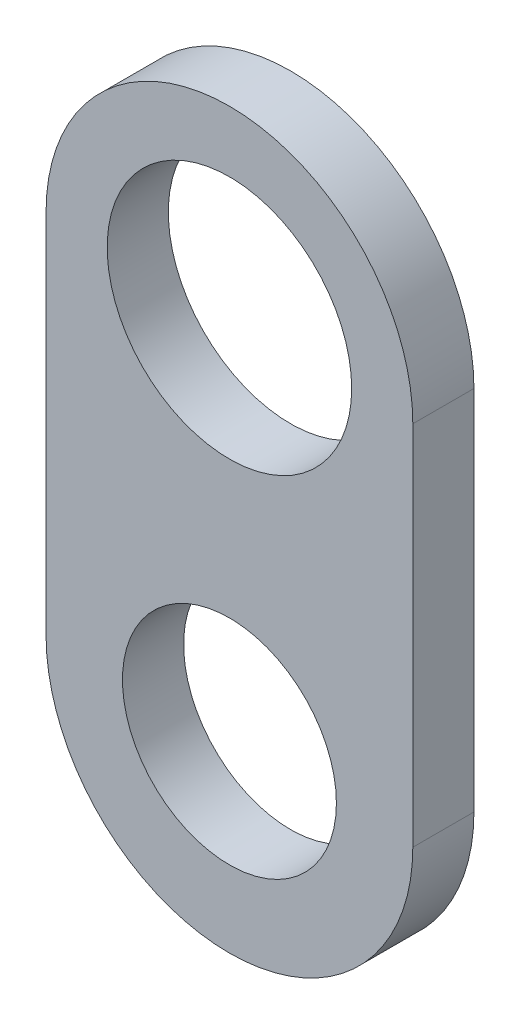
from build123d import *

# Parameters (mm, degrees)
BOSS_EXTRUDE1_DEPTH = 250
SKETCH2_R           = 500
SKETCH2_R_2         = 437.5
CUT_EXTRUDE1_DEPTH  = 250


with BuildPart() as part:
    # Sketch1 → Boss-Extrude1 (new body)
    with BuildSketch(Plane.XY):
        with BuildLine():
            Line((-750, 0), (-750, -1500))
            ThreePointArc((-750, -1500), (0, -2250), (750, -1500))
            Line((750, -1500), (750, 0))
            ThreePointArc((750, 0), (0, 750), (-750, 0))
        make_face()
    extrude(amount=BOSS_EXTRUDE1_DEPTH)

    # Sketch2 → Cut-Extrude1 (cut)
    with BuildSketch(Plane.XY.offset(250)):
        Circle(SKETCH2_R)
        with Locations((0, -1500)):
            Circle(SKETCH2_R_2)
    extrude(amount=-CUT_EXTRUDE1_DEPTH, mode=Mode.SUBTRACT)


solid = part.part
